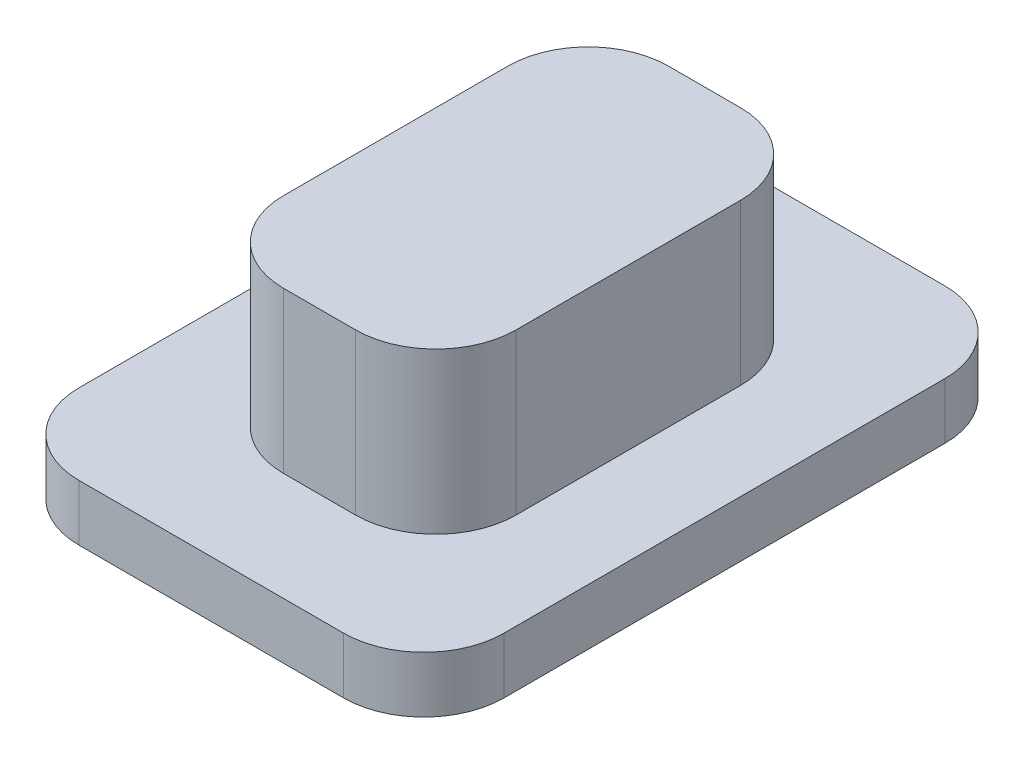
from build123d import *

# Parameters (mm, degrees)
EXTRUDE_1_DEPTH = 0.7
EXTRUDE_3_DEPTH = 2.7


with BuildPart() as part:
    # 草图1 → 凸台-拉伸1 (new body)
    with BuildSketch(Plane(origin=(0, 0, 0), x_dir=(1, 0, 0), z_dir=(0, 1, 0))):
        with BuildLine():
            Line((0.383333333, 5.483035714), (-2.916666667, 5.483035714))
            ThreePointArc((-2.916666667, 5.483035714), (-3.623773448, 5.190142495), (-3.916666667, 4.483035714))
            Line((-3.916666667, 4.483035714), (-3.916666667, -1.016964286))
            ThreePointArc((-3.916666667, -1.016964286), (-3.623773448, -1.724071067), (-2.916666667, -2.016964286))
            Line((-2.916666667, -2.016964286), (0.383333333, -2.016964286))
            ThreePointArc((0.383333333, -2.016964286), (1.090440115, -1.724071067), (1.383333333, -1.016964286))
            Line((1.383333333, -1.016964286), (1.383333333, 4.483035714))
            ThreePointArc((1.383333333, 4.483035714), (1.090440115, 5.190142495), (0.383333333, 5.483035714))
        make_face()
        with BuildLine():
            ThreePointArc((-2.716666667, 3.133035714), (-2.423773448, 3.840142495), (-1.716666667, 4.133035714))
            Line((-1.716666667, 4.133035714), (-0.816666667, 4.133035714))
            ThreePointArc((-0.816666667, 4.133035714), (-0.109559885, 3.840142495), (0.183333333, 3.133035714))
            Line((0.183333333, 3.133035714), (0.183333333, 0.333035714))
            ThreePointArc((0.183333333, 0.333035714), (-0.109559885, -0.374071067), (-0.816666667, -0.666964286))
            Line((-0.816666667, -0.666964286), (-1.716666667, -0.666964286))
            ThreePointArc((-1.716666667, -0.666964286), (-2.423773448, -0.374071067), (-2.716666667, 0.333035714))
            Line((-2.716666667, 0.333035714), (-2.716666667, 3.133035714))
        make_face(mode=Mode.SUBTRACT)
    extrude(amount=EXTRUDE_1_DEPTH)

    # 草图1<6> → 凸台-拉伸3 (add)
    with BuildSketch(Plane(origin=(0, 0, 0), x_dir=(1, 0, 0), z_dir=(0, 1, 0))):
        with BuildLine():
            Line((-0.816666667, 4.133035714), (-1.716666667, 4.133035714))
            ThreePointArc((-1.716666667, 4.133035714), (-2.423773448, 3.840142495), (-2.716666667, 3.133035714))
            Line((-2.716666667, 3.133035714), (-2.716666667, 0.333035714))
            ThreePointArc((-2.716666667, 0.333035714), (-2.423773448, -0.374071067), (-1.716666667, -0.666964286))
            Line((-1.716666667, -0.666964286), (-0.816666667, -0.666964286))
            ThreePointArc((-0.816666667, -0.666964286), (-0.109559885, -0.374071067), (0.183333333, 0.333035714))
            Line((0.183333333, 0.333035714), (0.183333333, 3.133035714))
            ThreePointArc((0.183333333, 3.133035714), (-0.109559885, 3.840142495), (-0.816666667, 4.133035714))
        make_face()
    extrude(amount=EXTRUDE_3_DEPTH)


solid = part.part
